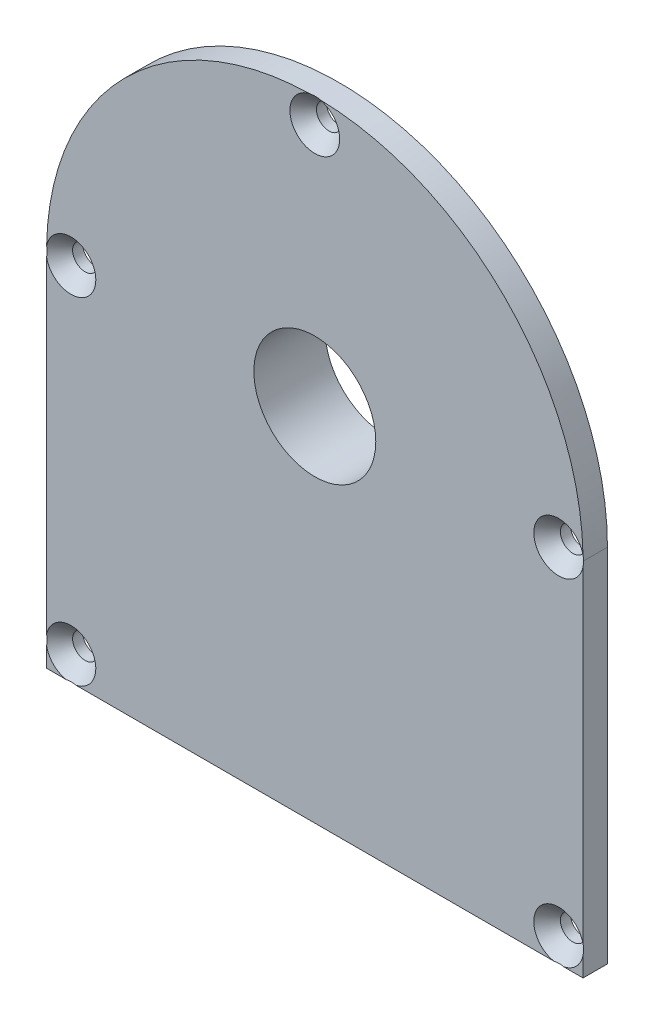
from build123d import *

# Parameters (mm, degrees)
BOSS_EXTRUDE1_DEPTH                           = 3.175
SKETCH2_R                                     = 7.9375
CUT_EXTRUDE1_DEPTH                            = 3.175
CSK_FOR_4_FLAT_HEAD_SOCKET_CAP_SCREW1_A_COUNT = 2
CSK_FOR_4_FLAT_HEAD_SOCKET_CAP_SCREW1_A_PITCH = 44.901280605
CSK_FOR_4_FLAT_HEAD_SOCKET_CAP_SCRE_2_COUNT   = 2
CSK_FOR_4_FLAT_HEAD_SOCKET_CAP_SCRE_2_PITCH   = 44.901280605
CSK_FOR_4_FLAT_HEAD_SOCKET_CAP_SCRE_3_COUNT   = 2
CSK_FOR_4_FLAT_HEAD_SOCKET_CAP_SCRE_3_PITCH   = 81.964210025
CSK_FOR_4_FLAT_HEAD_SOCKET_CAP_SCRE_4_COUNT   = 2
CSK_FOR_4_FLAT_HEAD_SOCKET_CAP_SCRE_4_PITCH   = 81.964210025
SKETCH6_R                                     = 11.1125
SKETCH6_R_2                                   = 7.9375
BOSS_EXTRUDE2_DEPTH                           = 6.096
SKETCH7_R                                     = 8.73125
SKETCH7_R_2                                   = 6.35
BOSS_EXTRUDE3_DEPTH                           = 3.556
CUT_EXTRUDE2_START                            = -2.032
SKETCH8_R                                     = 6.35
CUT_EXTRUDE2_DEPTH                            = 2.032
FILLET1_R                                     = 3.175


with BuildPart() as part:
    # Sketch1 → Boss-Extrude1 (new body)
    with BuildSketch(Plane.XY):
        with BuildLine():
            Line((-34.925, 5.715), (-34.925, -41.275))
            Line((-34.925, -41.275), (34.925, -41.275))
            Line((34.925, -41.275), (34.925, 5.715))
            ThreePointArc((34.925, 5.715), (0, 40.64), (-34.925, 5.715))
        make_face()
    extrude(amount=BOSS_EXTRUDE1_DEPTH)

    # Sketch2 → Cut-Extrude1 (cut)
    with BuildSketch(Plane.XY.offset(3.175)):
        with Locations((0, 5.715)):
            Circle(SKETCH2_R)
    extrude(amount=-CUT_EXTRUDE1_DEPTH, mode=Mode.SUBTRACT)

    # Sketch5 → CSK for #4 Flat Head Socket Cap Screw1 (revolve, cut)
    with BuildSketch(Plane(origin=(0, 37.465, 3.175), x_dir=(0, -1, 0), z_dir=(1, 0, 0))):
        Polygon((0, 0), (0, 3.175), (1.63195, 3.175), (1.63195, 1.848124365), (3.2385, 0), align=None)
    csk_for_4_flat_head_socket_cap_screw1 = revolve(axis=Axis((0, 37.465, 9.525), (0, 0, -1)), mode=Mode.SUBTRACT)

    # CSK for #4 Flat Head Socket Cap Screw1 a: CSK for #4 Flat Head Socket Cap Screw1 ×2
    with Locations(*[Vector(-0.7071067811865475, -0.7071067811865476, 0) * (i * CSK_FOR_4_FLAT_HEAD_SOCKET_CAP_SCREW1_A_PITCH) for i in range(1, CSK_FOR_4_FLAT_HEAD_SOCKET_CAP_SCREW1_A_COUNT)]):
        add(csk_for_4_flat_head_socket_cap_screw1, mode=Mode.SUBTRACT)

    # CSK for _4 Flat Head Socket Cap Scre 2: CSK for #4 Flat Head Socket Cap Screw1 ×2
    with Locations(*[Vector(0.7071067811865475, -0.7071067811865477, 0) * (i * CSK_FOR_4_FLAT_HEAD_SOCKET_CAP_SCRE_2_PITCH) for i in range(1, CSK_FOR_4_FLAT_HEAD_SOCKET_CAP_SCRE_2_COUNT)]):
        add(csk_for_4_flat_head_socket_cap_screw1, mode=Mode.SUBTRACT)

    # CSK for _4 Flat Head Socket Cap Scre 3: CSK for #4 Flat Head Socket Cap Screw1 ×2
    with Locations(*[Vector(0.3873641921317683, -0.9219267772736089, 0) * (i * CSK_FOR_4_FLAT_HEAD_SOCKET_CAP_SCRE_3_PITCH) for i in range(1, CSK_FOR_4_FLAT_HEAD_SOCKET_CAP_SCRE_3_COUNT)]):
        add(csk_for_4_flat_head_socket_cap_screw1, mode=Mode.SUBTRACT)

    # CSK for _4 Flat Head Socket Cap Scre 4: CSK for #4 Flat Head Socket Cap Screw1 ×2
    with Locations(*[Vector(-0.3873641921317683, -0.9219267772736089, 0) * (i * CSK_FOR_4_FLAT_HEAD_SOCKET_CAP_SCRE_4_PITCH) for i in range(1, CSK_FOR_4_FLAT_HEAD_SOCKET_CAP_SCRE_4_COUNT)]):
        add(csk_for_4_flat_head_socket_cap_screw1, mode=Mode.SUBTRACT)

    # Sketch6 → Boss-Extrude2 (add)
    with BuildSketch(Plane(origin=(0, 0, 0), x_dir=(-1, 0, 0), z_dir=(0, 0, -1))):
        with Locations(Location((0, 5.715, 0), (0, 0, 180))):
            Circle(SKETCH6_R)
        with Locations(Location((0, 5.715, 0), (0, 0, 180))):
            Circle(SKETCH6_R_2, mode=Mode.SUBTRACT)
    extrude(amount=BOSS_EXTRUDE2_DEPTH)

    # Sketch7 → Boss-Extrude3 (add)
    with BuildSketch(Plane(origin=(0, 0, 0), x_dir=(-1, 0, 0), z_dir=(0, 0, -1))):
        with Locations(Location((15.875, -25.393519733, 0), (0, 0, 180))):
            Circle(SKETCH7_R)
        with Locations((15.875, -25.393519733)):
            Circle(SKETCH7_R_2, mode=Mode.SUBTRACT)
    extrude(amount=BOSS_EXTRUDE3_DEPTH)

    # Sketch8 → Cut-Extrude2 (cut)
    with BuildSketch(Plane(origin=(0, 0, 0), x_dir=(-1, 0, 0), z_dir=(0, 0, -1)).offset(CUT_EXTRUDE2_START)):
        with Locations((15.875, -25.393519733)):
            Circle(SKETCH8_R)
    extrude(amount=CUT_EXTRUDE2_DEPTH, mode=Mode.SUBTRACT)

    # Fillet1
    fillet1_edges = [part.edges().sort_by_distance(p)[0] for p in [
        (-11.1125, 5.715, 0),
        (-24.60625, -25.393519733, 0),
    ]]
    fillet(fillet1_edges, radius=FILLET1_R)


solid = part.part
